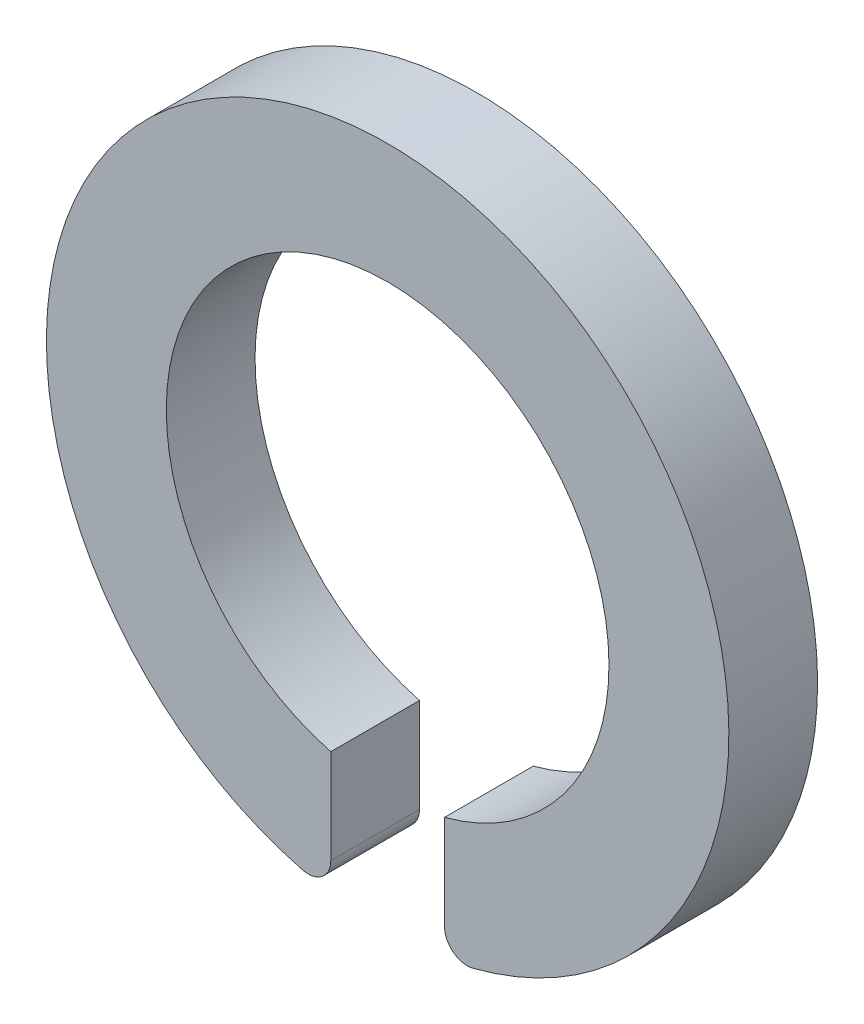
from build123d import *

# Parameters (mm, degrees)
SKETCH1_R           = 7.5
SKETCH1_R_2         = 4.865
BOSS_EXTRUDE1_DEPTH = 1.95
SKETCH2_W           = 2.5
SKETCH2_H           = 4.968115063
CUT_EXTRUDE1_DEPTH  = 11.784363681
FILLET1_R           = 0.5


with BuildPart() as part:
    # Sketch1 → Boss-Extrude1 (new body)
    with BuildSketch(Plane.XY):
        Circle(SKETCH1_R)
        Circle(SKETCH1_R_2, mode=Mode.SUBTRACT)
    extrude(amount=BOSS_EXTRUDE1_DEPTH)

    # Sketch2 → Cut-Extrude1 (cut, through all)
    with BuildSketch(Plane.XY.offset(1.95)):
        with Locations((0, -6.251822647)):
            Rectangle(SKETCH2_W, SKETCH2_H)
    extrude(amount=-CUT_EXTRUDE1_DEPTH, mode=Mode.SUBTRACT)

    # Fillet1
    fillet1_edges = [part.edges().sort_by_distance(p)[0] for p in [
        (-1.25, -7.395099729, 0.975),
        (1.25, -7.395099729, 0.975),
    ]]
    fillet(fillet1_edges, radius=FILLET1_R)


solid = part.part
